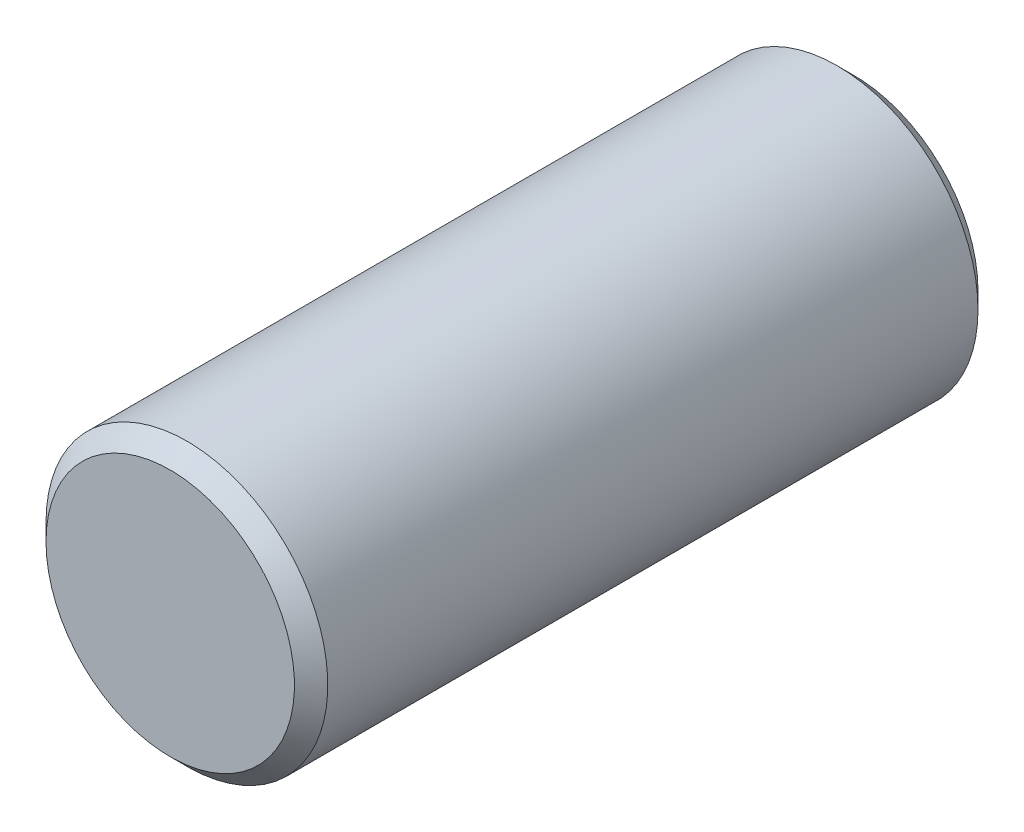
from build123d import *

# Parameters (mm, degrees)
SKETCH1_R           = 429.26
BOSS_EXTRUDE1_DEPTH = 1041.4
CHAMFER1_SIZE       = 50.8


with BuildPart() as part:
    # Sketch1 → Boss-Extrude1 (new, symmetric)
    with BuildSketch(Plane.XY):
        Circle(SKETCH1_R)
    extrude(amount=BOSS_EXTRUDE1_DEPTH, both=True)

    # Chamfer1
    chamfer1_edges = [part.edges().sort_by_distance(p)[0] for p in [
        (-429.26, 0, -1041.4),
        (-429.26, 0, 1041.4),
    ]]
    chamfer(chamfer1_edges, length=CHAMFER1_SIZE)


solid = part.part
